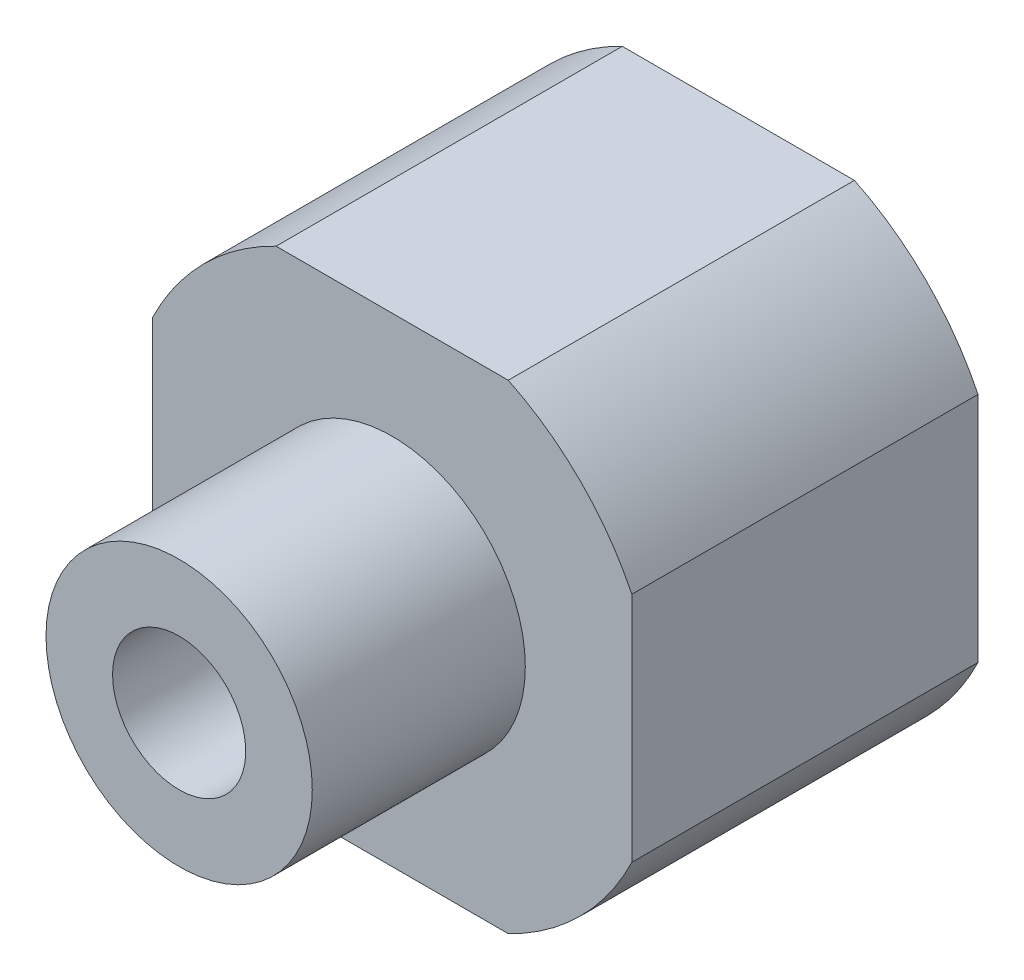
from build123d import *

# Parameters (mm, degrees)
BOSS_EXTRUDE2_DEPTH = 13
SKETCH2_R           = 5
BOSS_EXTRUDE3_DEPTH = 21
SKETCH4_R           = 2.5
CUT_EXTRUDE1_DEPTH  = 21


with BuildPart() as part:
    # Sketch1 → Boss-Extrude2 (new body)
    with BuildSketch(Plane.XY):
        with BuildLine():
            Line((-4.358898944, 9), (4.358898944, 9))
            ThreePointArc((4.358898944, 9), (7.071067812, 7.071067812), (9, 4.358898944))
            Line((9, 4.358898944), (9, -4.358898944))
            ThreePointArc((9, -4.358898944), (7.071067812, -7.071067812), (4.358898944, -9))
            Line((4.358898944, -9), (-4.358898944, -9))
            ThreePointArc((-4.358898944, -9), (-7.071067812, -7.071067812), (-9, -4.358898944))
            Line((-9, -4.358898944), (-9, 4.358898944))
            ThreePointArc((-9, 4.358898944), (-7.071067812, 7.071067812), (-4.358898944, 9))
        make_face()
    extrude(amount=BOSS_EXTRUDE2_DEPTH)

    # Sketch2 → Boss-Extrude3 (add)
    with BuildSketch(Plane.XY):
        with Locations(Location((0, 0, 0), (0, 0, 180))):
            Circle(SKETCH2_R)
    extrude(amount=BOSS_EXTRUDE3_DEPTH)

    # Sketch4 → Cut-Extrude1 (cut)
    with BuildSketch(Plane.XY):
        with Locations(Location((0, 0, 0), (0, 0, 180))):
            Circle(SKETCH4_R)
    extrude(amount=CUT_EXTRUDE1_DEPTH, mode=Mode.SUBTRACT)


solid = part.part
